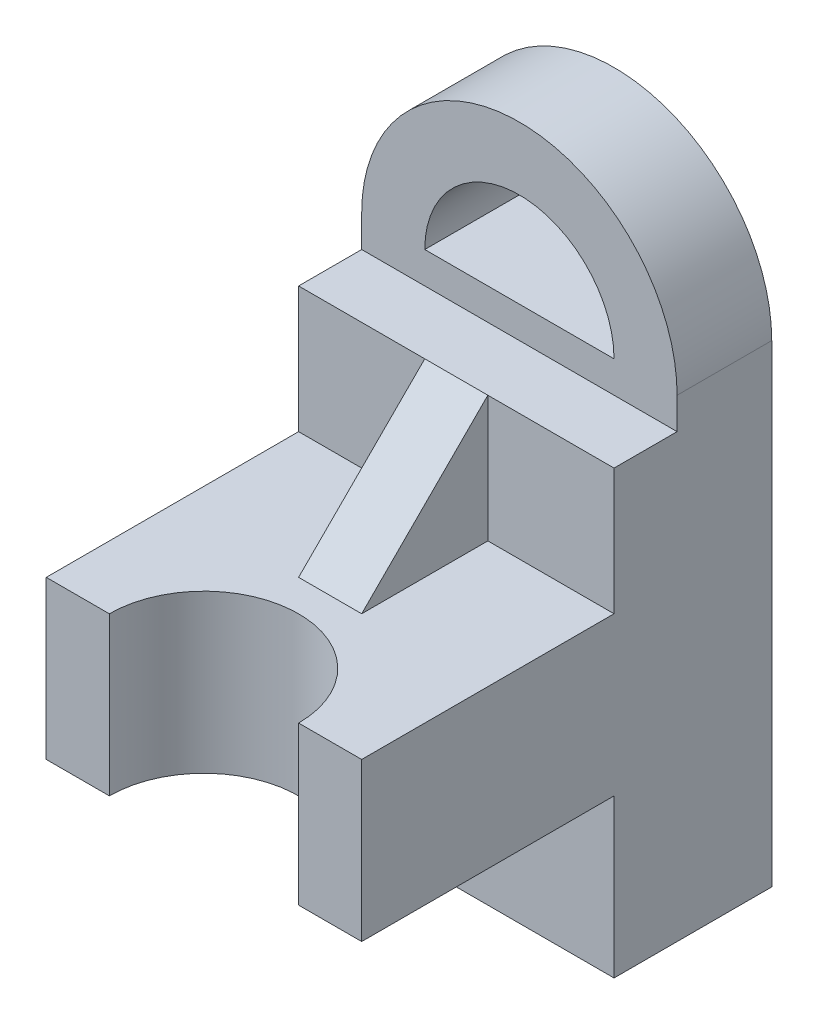
from build123d import *

# Parameters (mm, degrees)
BOSS_EXTRUDE2_DEPTH = 15
CUT_EXTRUDE2_DEPTH  = 15
SKETCH5_W           = 50
SKETCH5_H           = 70
BOSS_EXTRUDE3_DEPTH = 10
SKETCH6_W           = 40
SKETCH6_H           = 25
BOSS_EXTRUDE4_DEPTH = 50
RIB1_REACH          = 95.575
SKETCH10_WALL_W     = 217.43394397
SKETCH10_WALL_H     = 10
SKETCH11_R          = 15
CUT_EXTRUDE3_DEPTH  = 25


with BuildPart() as part:
    # Sketch2 → Boss-Extrude2 (new body)
    with BuildSketch(Plane.XY):
        with BuildLine():
            Line((-25, 37.5), (-25, -37.5))
            Line((-25, -37.5), (25, -37.5))
            Line((25, -37.5), (25, 37.5))
            ThreePointArc((25, 37.5), (0, 62.5), (-25, 37.5))
        make_face()
    extrude(amount=BOSS_EXTRUDE2_DEPTH)

    # Sketch4 → Cut-Extrude2 (cut)
    with BuildSketch(Plane.XY.offset(15)):
        with BuildLine():
            Line((-15, 37.5), (15, 37.5))
            ThreePointArc((15, 37.5), (0, 52.5), (-15, 37.5))
        make_face()
    extrude(amount=-CUT_EXTRUDE2_DEPTH, mode=Mode.SUBTRACT)

    # Sketch5 → Boss-Extrude3 (add)
    with BuildSketch(Plane.XY.offset(15)):
        with Locations((0, -2.5)):
            Rectangle(SKETCH5_W, SKETCH5_H)
    extrude(amount=BOSS_EXTRUDE3_DEPTH)

    # Sketch6 → Boss-Extrude4 (add)
    with BuildSketch(Plane.ZY.offset(25)):
        with Locations((45, 0)):
            Rectangle(SKETCH6_W, SKETCH6_H)
    extrude(amount=-BOSS_EXTRUDE4_DEPTH)

    # Sketch10 wall → Rib1 (add, up to next)
    with BuildSketch(Plane(origin=(0, 22.5, 35), x_dir=(0, -0.707106781187, 0.707106781187), z_dir=(0, -0.707106781187, -0.707106781187)), mode=Mode.PRIVATE) as rib1_sk1:
        Rectangle(SKETCH10_WALL_W, SKETCH10_WALL_H)
    rib1_tool1 = extrude(rib1_sk1.sketch, amount=RIB1_REACH, mode=Mode.PRIVATE) - part.part
    add(rib1_tool1.solids().sort_by_distance((0, 22.5, 35))[0])

    # Sketch11 → Cut-Extrude3 (cut)
    with BuildSketch(Plane(origin=(0, 12.5, 0), x_dir=(1, 0, 0), z_dir=(0, 1, 0))):
        with Locations((0, -65)):
            Circle(SKETCH11_R)
    extrude(amount=-CUT_EXTRUDE3_DEPTH, mode=Mode.SUBTRACT)


solid = part.part
